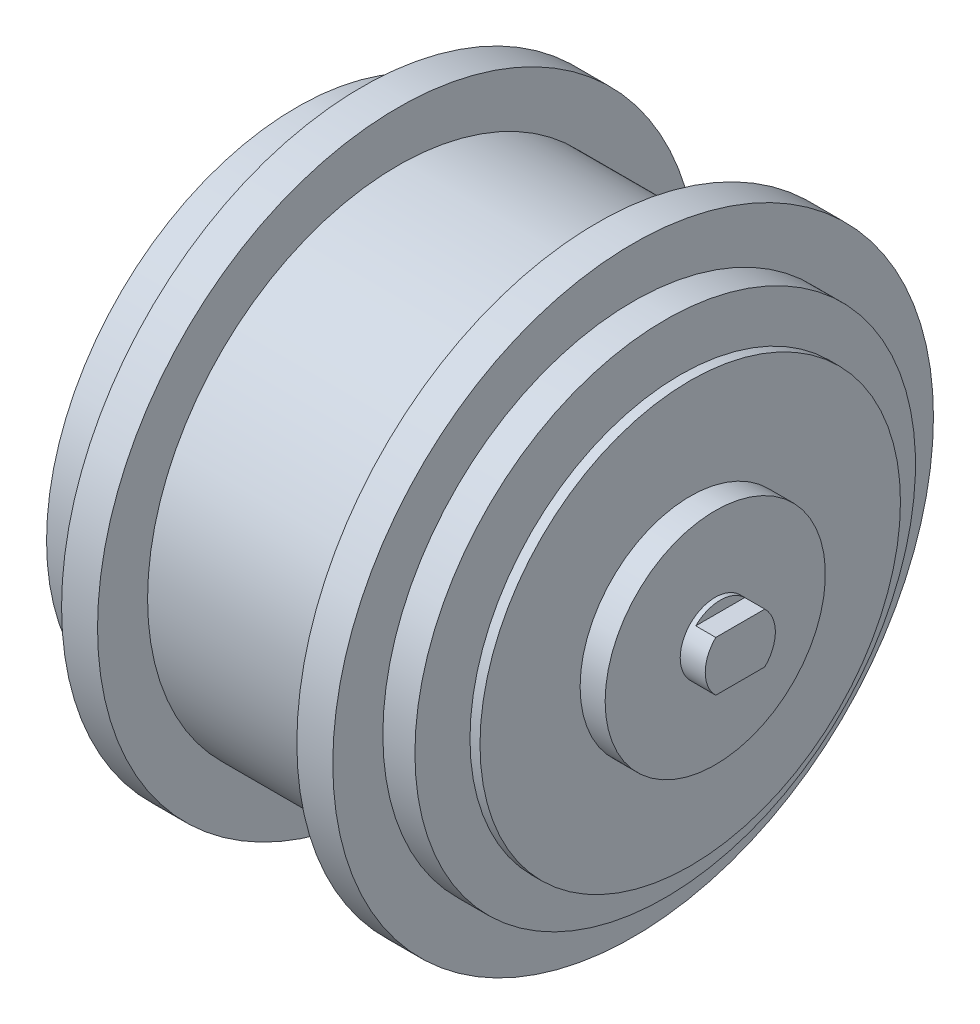
from build123d import *

# Parameters (mm, degrees)
CUT_EXTRUDE1_DEPTH      = 4
CUT_EXTRUDE2_DEPTH      = 139.260282077
CUT_EXTRUDE2_DEPTH_BACK = 3
SKETCH3_R               = 8.5


with BuildPart() as part:
    # Sketch1 → Revolve1 (revolve)
    with BuildSketch(Plane.XY, mode=Mode.PRIVATE) as revolve1_sk:
        Polygon((0, 0), (0, 6), (33, 6), (33, 8.5), (43.5, 8.5), (43.5, 17), (46.5, 17), (46.5, 36.31855833), (53.568965517, 50), (66.568965517, 50), (66.568965517, 60), (73.751034483, 60), (73.751034483, 50), (113.568965517, 50), (113.568965517, 60), (120.751034483, 60), (120.751034483, 50), (127.16, 50), (127.16, 22), (130.16, 22), (130.16, 42), (132.16, 42), (132.16, 22), (137.16, 22), (137.16, 7), (142.16, 7), (142.16, 0), align=None)
    revolve(revolve1_sk.sketch.rotate(Axis((0, 0, 0), (1, 0, 0)), 90), axis=Axis((0, 0, 0), (1, 0, 0)))

    # Sketch2 → Cut-Extrude1 (cut)
    with BuildSketch(Plane(origin=(142.16, 0, 0), x_dir=(0, 0, -1), z_dir=(1, 0, 0))):
        with BuildLine():
            Line((-4.898979486, 5), (4.898979486, 5))
            ThreePointArc((4.898979486, 5), (0, 7), (-4.898979486, 5))
        make_face()
        with BuildLine():
            Line((-4.898979486, -5), (4.898979486, -5))
            ThreePointArc((4.898979486, -5), (0, -7), (-4.898979486, -5))
        make_face()
    extrude(amount=-CUT_EXTRUDE1_DEPTH, mode=Mode.SUBTRACT)

    # Sketch3 → Cut-Extrude2 (cut, two sides: drawn at the far end of the back side and taken through both)
    with BuildSketch(Plane.ZY.offset(-33).offset(-CUT_EXTRUDE2_DEPTH_BACK)):
        Circle(SKETCH3_R)
    extrude(amount=CUT_EXTRUDE2_DEPTH + CUT_EXTRUDE2_DEPTH_BACK, mode=Mode.SUBTRACT)


solid = part.part
